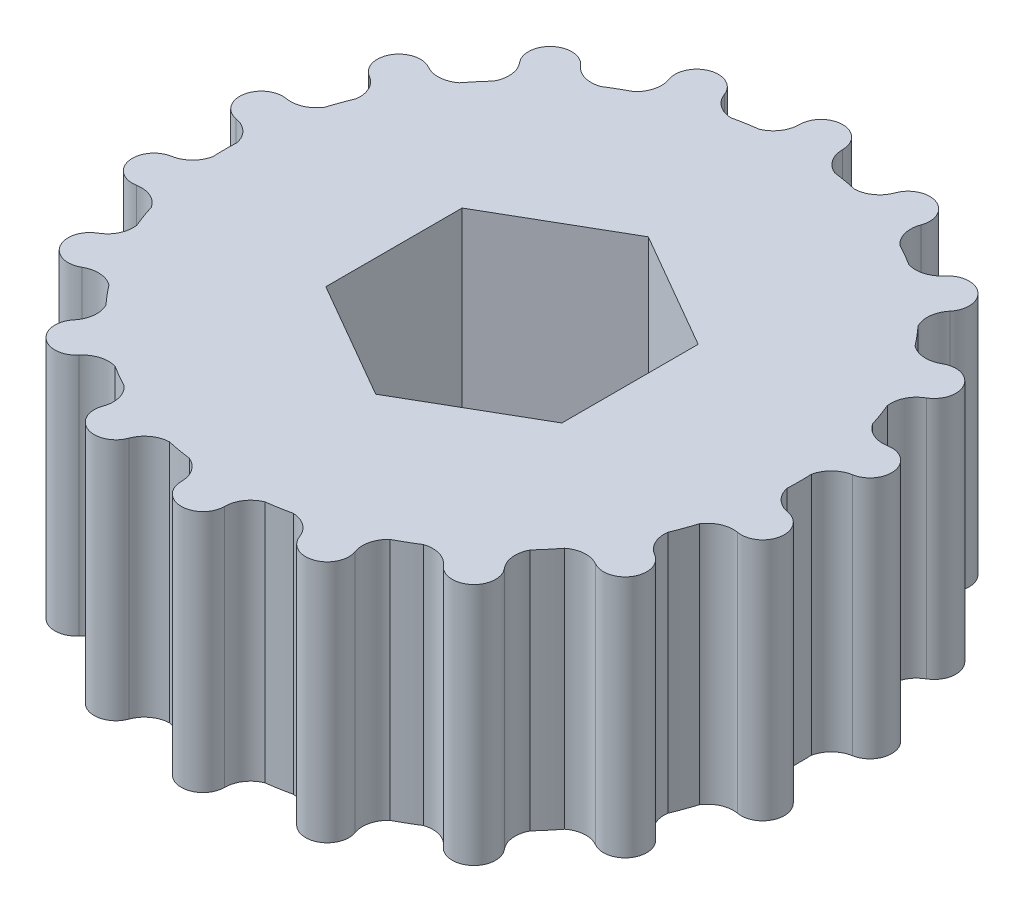
from build123d import *

# Parameters (mm, degrees)
SKETCH1_R           = 11.811
BOSS_EXTRUDE1_DEPTH = 10
BOSS_EXTRUDE2_START = -10
BOSS_EXTRUDE2_DEPTH = 10
CIRPATTERN1_COUNT   = 18


with BuildPart() as part:
    # Sketch1 → Boss-Extrude1 (new body)
    with BuildSketch(Plane(origin=(0, 0, 0), x_dir=(1, 0, 0), z_dir=(0, 1, 0))):
        with Locations(Location((0, 0, 0), (0, 0, 270))):
            Circle(SKETCH1_R)
        Polygon((0, 5.600297611), (-4.85, 2.800148806), (-4.85, -2.800148806), (0, -5.600297611), (4.85, -2.800148806), (4.85, 2.800148806), align=None, mode=Mode.SUBTRACT)
    extrude(amount=BOSS_EXTRUDE1_DEPTH)

    # Sketch2 → Boss-Extrude2 (add)
    with BuildSketch(Plane(origin=(0, 10, 0), x_dir=(1, 0, 0), z_dir=(0, 1, 0)).offset(BOSS_EXTRUDE2_START)):
        with BuildLine():
            ThreePointArc((0.889, 12.7), (0, 13.589), (-0.889, 12.7))
            ThreePointArc((-0.889, 12.7), (-1.070430373, 12.103223599), (-1.553320634, 11.70841219))
            ThreePointArc((-1.553320634, 11.70841219), (0, 11.811), (1.553320634, 11.70841219))
            ThreePointArc((1.553320634, 11.70841219), (1.070430373, 12.103223599), (0.889, 12.7))
        make_face()
    boss_extrude2 = extrude(amount=BOSS_EXTRUDE2_DEPTH)

    # CirPattern1: Boss-Extrude2 ×18 about axis
    cirpattern1_axis = Axis((0, 0, 0), (0, 1, 0))
    for i in range(1, CIRPATTERN1_COUNT):
        add(boss_extrude2.rotate(cirpattern1_axis, i * 360 / CIRPATTERN1_COUNT))


solid = part.part
